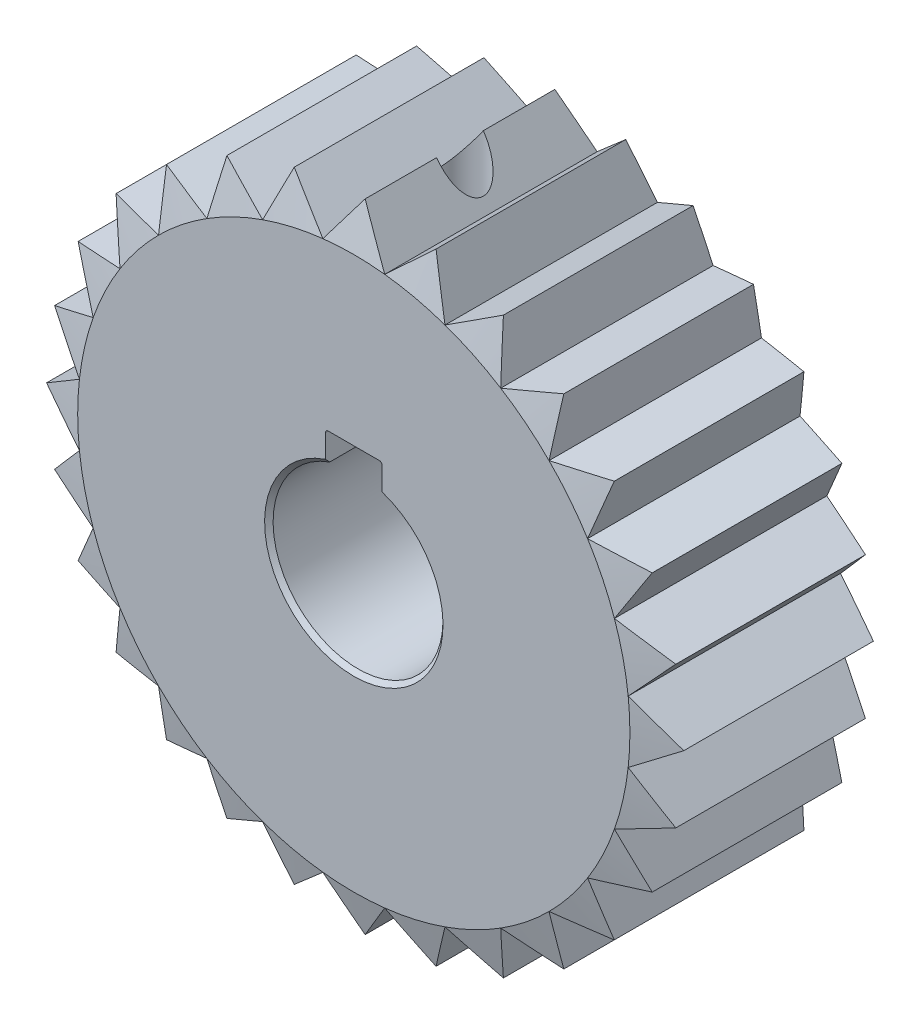
from build123d import *

# Parameters (mm, degrees)
SKETCH_2_R          = 45
CUT_EXTRUDE_1_DEPTH = 15
CUT_EXTRUDE_2_DEPTH = 27
SKETCH_4_W          = 1.65
SKETCH_4_H          = 14.7


with BuildPart() as part:
    # 草图1 → 旋转1 (revolve)
    with BuildSketch(Plane(origin=(0, 0, 0), x_dir=(0, 0, -1), z_dir=(1, 0, 0))):
        Polygon((-15, 19.5), (-15, 6.3), (-14.7, 6), (-0.3, 6), (0, 6.3), (0, 19.5), (-0.803847577, 22.5), (-14.196152423, 22.5), align=None)
    revolve(axis=Axis((0, 0, 0), (0, 0, 1)))

    # 草图2 → 切除-拉伸1 (cut)
    with BuildSketch(Plane.XY):
        Circle(SKETCH_2_R)
        Polygon((-22.5, 0), (-19.377388093, -2.183307284), (-21.935878024, -5.006721014), (-18.405724941, -6.440441708), (-20.271799528, -9.76238413), (-16.511121885, -10.374625492), (-17.591208356, -14.028520542), (-13.788582233, -13.788582233), (-14.028520542, -17.591208356), (-10.374625492, -16.511121885), (-9.76238413, -20.271799528), (-6.440441708, -18.405724941), (-5.006721014, -21.935878024), (-2.183307284, -19.377388093), (0, -22.5), (2.183307284, -19.377388093), (5.006721014, -21.935878024), (6.440441708, -18.405724941), (9.76238413, -20.271799528), (10.374625492, -16.511121885), (14.028520542, -17.591208356), (13.788582233, -13.788582233), (17.591208356, -14.028520542), (16.511121885, -10.374625492), (20.271799528, -9.76238413), (18.405724941, -6.440441708), (21.935878024, -5.006721014), (19.377388093, -2.183307284), (22.5, 0), (19.377388093, 2.183307284), (21.935878024, 5.006721014), (18.405724941, 6.440441708), (20.271799528, 9.76238413), (16.511121885, 10.374625492), (17.591208356, 14.028520542), (13.788582233, 13.788582233), (14.028520542, 17.591208356), (10.374625492, 16.511121885), (9.76238413, 20.271799528), (6.440441708, 18.405724941), (5.006721014, 21.935878024), (2.183307284, 19.377388093), (0, 22.5), (-2.183307284, 19.377388093), (-5.006721014, 21.935878024), (-6.440441708, 18.405724941), (-9.76238413, 20.271799528), (-10.374625492, 16.511121885), (-14.028520542, 17.591208356), (-13.788582233, 13.788582233), (-17.591208356, 14.028520542), (-16.511121885, 10.374625492), (-20.271799528, 9.76238413), (-18.405724941, 6.440441708), (-21.935878024, 5.006721014), (-19.377388093, 2.183307284), align=None, mode=Mode.SUBTRACT)
    extrude(amount=CUT_EXTRUDE_1_DEPTH, mode=Mode.SUBTRACT)

    # 草图3 → 切除-拉伸2 (cut)
    with BuildSketch(Plane.XY):
        with BuildLine():
            Line((-2, 0), (2, 0))
            Line((2, 0), (2, 7.6))
            ThreePointArc((2, 7.6), (1.941421356, 7.741421356), (1.8, 7.8))
            Line((1.8, 7.8), (-1.8, 7.8))
            ThreePointArc((-1.8, 7.8), (-1.941421356, 7.741421356), (-2, 7.6))
            Line((-2, 7.6), (-2, 0))
        make_face()
    extrude(amount=CUT_EXTRUDE_2_DEPTH, mode=Mode.SUBTRACT)

    # 草图4 → M4 螺纹孔1 (revolve, cut)
    with BuildSketch(Plane(origin=(0, 7.8, 7.5), x_dir=(0, 0, -1), z_dir=(1, 0, 0))):
        with Locations((0.825, 7.35)):
            Rectangle(SKETCH_4_W, SKETCH_4_H)
    revolve(axis=Axis((0, 1.45, 7.5), (0, 1, 0)), mode=Mode.SUBTRACT)


solid = part.part
